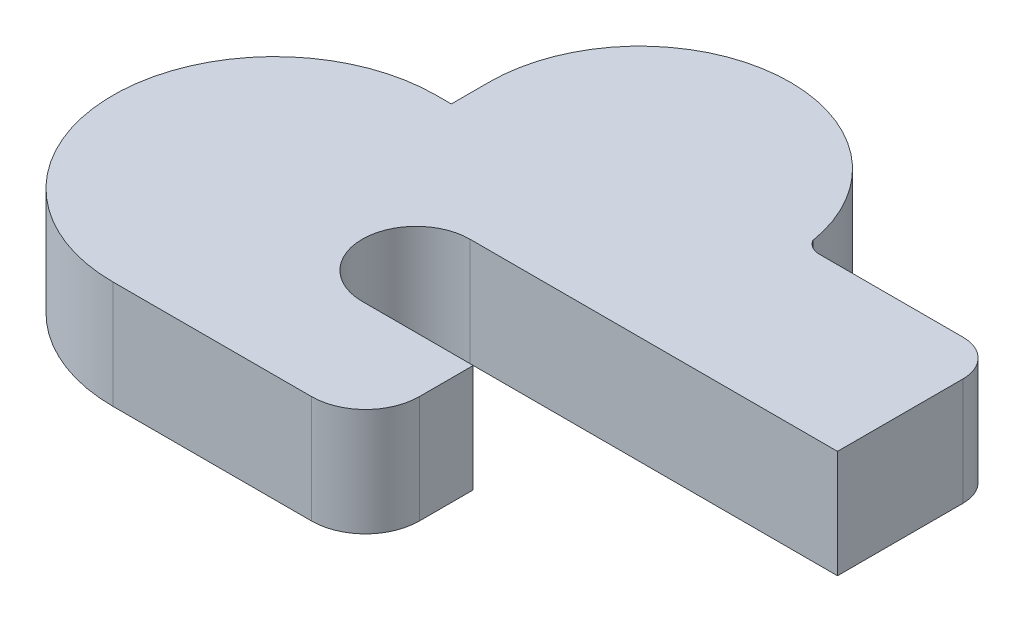
from build123d import *

# Parameters (mm, degrees)
BOSS_EXTRUDE2_DEPTH = 3


with BuildPart() as part:
    # Sketch1 → Boss-Extrude2 (new body)
    with BuildSketch(Plane(origin=(0, 0, 0), x_dir=(1, 0, 0), z_dir=(0, 1, 0))):
        with BuildLine():
            Line((0, 0), (-3.09, 0))
            ThreePointArc((-3.09, 0), (-4.59, 1.5), (-3.09, 3))
            Line((-3.09, 3), (7.13999998, 3))
            Line((7.13999998, 3), (7.13999998, 6.5))
            ThreePointArc((7.13999998, 6.5), (6.847106761, 7.207106781), (6.13999998, 7.5))
            Line((6.13999998, 7.5), (2.13999998, 7.5))
            ThreePointArc((2.13999998, 7.5), (1.895695773, 7.563748404), (1.71368758, 7.738738181))
            ThreePointArc((1.71368758, 7.738738181), (-2.763474149, 11.230000081), (-6.61000002, 7.054101912))
            Line((-6.61000002, 7.054101912), (-6.61000002, 6))
            Line((-6.61000002, 6), (-7.03000002, 6))
            ThreePointArc((-7.03000002, 6), (-11.53, 1.500427746), (-7.030855512, -2.999999919))
            Line((-7.030855512, -2.999999919), (-1.5, -2.999999919))
            ThreePointArc((-1.5, -2.999999919), (-0.439339828, -2.56066009), (0, -1.499999919))
            Line((0, -1.499999919), (0, 0))
        make_face()
    extrude(amount=BOSS_EXTRUDE2_DEPTH)


solid = part.part
